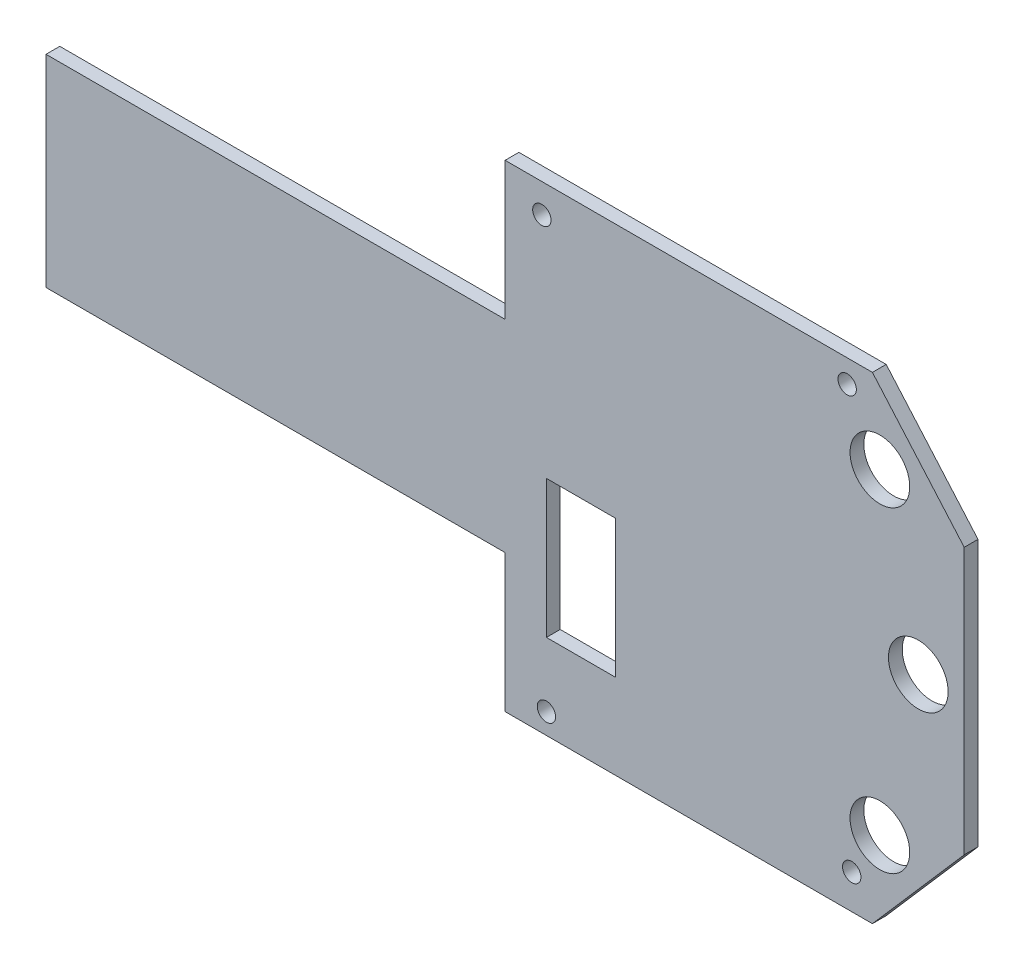
from build123d import *

# Parameters (mm, degrees)
RESSALTO_EXTRUS_O1_DEPTH = 3
ESBO_O2_W                = 15
ESBO_O2_H                = 30
CORTE_EXTRUS_O1_DEPTH    = 10
ESBO_O3_R                = 2
CORTE_EXTRUS_O2_DEPTH    = 10
ESBO_O4_R                = 2
CORTE_EXTRUS_O3_DEPTH    = 10
ESBO_O5_R                = 2
CORTE_EXTRUS_O4_DEPTH    = 10
ESBO_O6_R                = 2
CORTE_EXTRUS_O5_DEPTH    = 10
ESBO_O7_R                = 6.5
CORTE_EXTRUS_O6_DEPTH    = 10
ESBO_O8_R                = 6.5
CORTE_EXTRUS_O7_DEPTH    = 10


with BuildPart() as part:
    # Esboço1 → Ressalto-extrusão1 (new body)
    with BuildSketch(Plane.XY):
        Polygon((100, 0), (180, 0), (200, 23), (200, 81), (180, 104), (100, 104), (100, 74), (0, 74), (0, 30), (100, 30), align=None)
    extrude(amount=RESSALTO_EXTRUS_O1_DEPTH)

    # Esboço2 → Corte-extrusão1 (cut)
    with BuildSketch(Plane.XY.offset(3)):
        with Locations((116.5, 33.5)):
            Rectangle(ESBO_O2_W, ESBO_O2_H)
    extrude(amount=-CORTE_EXTRUS_O1_DEPTH, mode=Mode.SUBTRACT)

    # Esboço3 → Corte-extrusão2 (cut)
    with BuildSketch(Plane.XY.offset(3)):
        with Locations((109, 4.5)):
            Circle(ESBO_O3_R)
    extrude(amount=-CORTE_EXTRUS_O2_DEPTH, mode=Mode.SUBTRACT)

    # Esboço4 → Corte-extrusão3 (cut)
    with BuildSketch(Plane.XY.offset(3)):
        with Locations((175.5, 7.5)):
            Circle(ESBO_O4_R)
    extrude(amount=-CORTE_EXTRUS_O3_DEPTH, mode=Mode.SUBTRACT)

    # Esboço5 → Corte-extrusão4 (cut)
    with BuildSketch(Plane.XY.offset(3)):
        with Locations((108, 97.7)):
            Circle(ESBO_O5_R)
    extrude(amount=-CORTE_EXTRUS_O4_DEPTH, mode=Mode.SUBTRACT)

    # Esboço6 → Corte-extrusão5 (cut)
    with BuildSketch(Plane.XY.offset(3)):
        with Locations((174.5, 99)):
            Circle(ESBO_O6_R)
    extrude(amount=-CORTE_EXTRUS_O5_DEPTH, mode=Mode.SUBTRACT)

    # Esboço7 → Corte-extrusão6 (cut)
    with BuildSketch(Plane.XY.offset(3)):
        with Locations((181.63, 86.5)):
            Circle(ESBO_O7_R)
        with Locations((181.63, 17.5)):
            Circle(ESBO_O7_R)
    extrude(amount=-CORTE_EXTRUS_O6_DEPTH, mode=Mode.SUBTRACT)

    # Esboço8 → Corte-extrusão7 (cut)
    with BuildSketch(Plane.XY.offset(3)):
        with Locations((189.996600265, 52)):
            Circle(ESBO_O8_R)
    extrude(amount=-CORTE_EXTRUS_O7_DEPTH, mode=Mode.SUBTRACT)


solid = part.part
